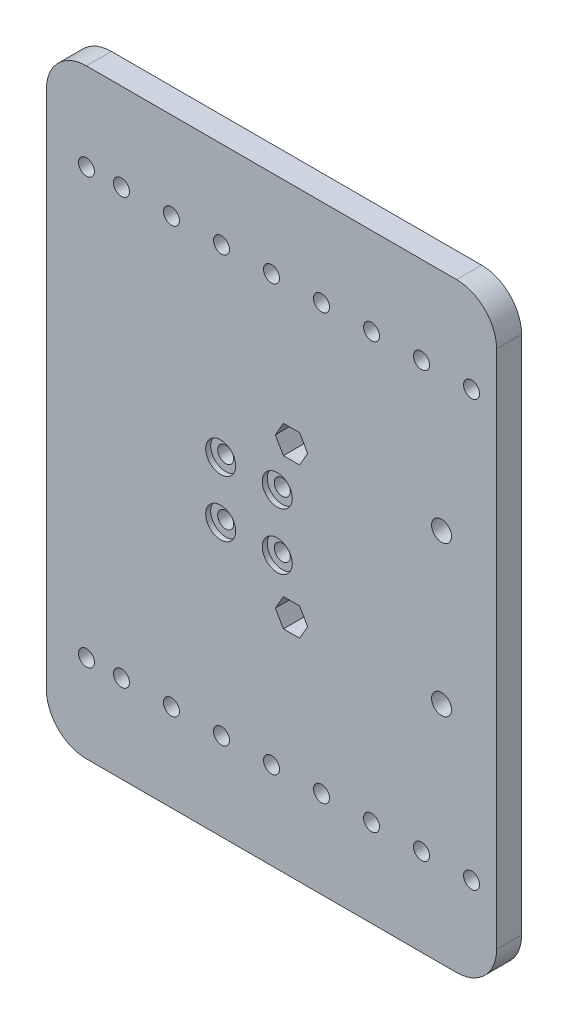
from build123d import *

# Parameters (mm, degrees)
SKETCH_1_W            = 90
SKETCH_1_H            = 120
SKETCH_1_R            = 2
SKETCH_1_R_2          = 1.6
EXTRUDE_1_DEPTH       = 5
FILLET_1_R            = 8
F_3_2_PCD16_R         = 1.6
CUT_EXTRUDE_3_2_DEPTH = 10
XRU1008_6_1_2_R       = 3
XRU1008_6_1_DEPTH     = 1


with BuildPart() as part:
    # 草图1 → 凸台-拉伸1 (new body)
    with BuildSketch(Plane.XY):
        with Locations((45, -60)):
            Rectangle(SKETCH_1_W, SKETCH_1_H)
        with Locations((79, -45)):
            Circle(SKETCH_1_R, mode=Mode.SUBTRACT)
        with Locations((79, -75)):
            Circle(SKETCH_1_R, mode=Mode.SUBTRACT)
        with Locations((85, -102.5)):
            Circle(SKETCH_1_R_2, mode=Mode.SUBTRACT)
        with Locations((75, -102.5)):
            Circle(SKETCH_1_R_2, mode=Mode.SUBTRACT)
        with Locations((65, -102.5)):
            Circle(SKETCH_1_R_2, mode=Mode.SUBTRACT)
        with Locations((55, -102.5)):
            Circle(SKETCH_1_R_2, mode=Mode.SUBTRACT)
        with Locations((45, -102.5)):
            Circle(SKETCH_1_R_2, mode=Mode.SUBTRACT)
        with Locations((85, -17.5)):
            Circle(SKETCH_1_R_2, mode=Mode.SUBTRACT)
        with Locations((75, -17.5)):
            Circle(SKETCH_1_R_2, mode=Mode.SUBTRACT)
        with Locations((65, -17.5)):
            Circle(SKETCH_1_R_2, mode=Mode.SUBTRACT)
        with Locations((55, -17.5)):
            Circle(SKETCH_1_R_2, mode=Mode.SUBTRACT)
        with Locations((45, -17.5)):
            Circle(SKETCH_1_R_2, mode=Mode.SUBTRACT)
        with Locations((35, -102.5)):
            Circle(SKETCH_1_R_2, mode=Mode.SUBTRACT)
        with Locations((25, -102.5)):
            Circle(SKETCH_1_R_2, mode=Mode.SUBTRACT)
        with Locations((15, -102.5)):
            Circle(SKETCH_1_R_2, mode=Mode.SUBTRACT)
        with Locations((35, -17.5)):
            Circle(SKETCH_1_R_2, mode=Mode.SUBTRACT)
        with Locations((25, -17.5)):
            Circle(SKETCH_1_R_2, mode=Mode.SUBTRACT)
        with Locations((15, -17.5)):
            Circle(SKETCH_1_R_2, mode=Mode.SUBTRACT)
        with Locations((8, -102.5)):
            Circle(SKETCH_1_R_2, mode=Mode.SUBTRACT)
        with Locations((8, -17.5)):
            Circle(SKETCH_1_R_2, mode=Mode.SUBTRACT)
        Polygon((50.616580754, -42.2), (47.383419246, -42.2), (45.766838493, -45), (47.383419246, -47.8), (50.616580754, -47.8), (52.233161507, -45), align=None, mode=Mode.SUBTRACT)
        Polygon((50.616580754, -72.2), (47.383419246, -72.2), (45.766838493, -75), (47.383419246, -77.8), (50.616580754, -77.8), (52.233161507, -75), align=None, mode=Mode.SUBTRACT)
    extrude(amount=EXTRUDE_1_DEPTH)

    # 圆角1
    fillet_1_edges = [part.edges().sort_by_distance(p)[0] for p in [
        (0, -120, 2.5),
        (90, -120, 2.5),
        (90, 0, 2.5),
        (0, 0, 2.5),
    ]]
    fillet(fillet_1_edges, radius=FILLET_1_R)

    # 内圈四孔_Ø3.2_PCD16 → 内圈四孔_通孔_Ø3.2 (cut)
    with BuildSketch(Plane(origin=(0, 0, 0), x_dir=(-1, 0, 0), z_dir=(0, 0, -1))):
        with Locations((-46.156854249, -54.343145751)):
            Circle(F_3_2_PCD16_R)
        with Locations((-34.843145751, -54.343145751)):
            Circle(F_3_2_PCD16_R)
        with Locations((-34.843145751, -65.656854249)):
            Circle(F_3_2_PCD16_R)
        with Locations((-46.156854249, -65.656854249)):
            Circle(F_3_2_PCD16_R)
    extrude(amount=-CUT_EXTRUDE_3_2_DEPTH, mode=Mode.SUBTRACT)

    # XRU1008__6___1 2 → XRU1008__6___1 (cut)
    with BuildSketch(Plane.XY.offset(5)):
        with Locations((46.156854249, -54.343145751)):
            Circle(XRU1008_6_1_2_R)
        with Locations((34.843145751, -54.343145751)):
            Circle(XRU1008_6_1_2_R)
        with Locations((34.843145751, -65.656854249)):
            Circle(XRU1008_6_1_2_R)
        with Locations((46.156854249, -65.656854249)):
            Circle(XRU1008_6_1_2_R)
    extrude(amount=-XRU1008_6_1_DEPTH, mode=Mode.SUBTRACT)


solid = part.part
